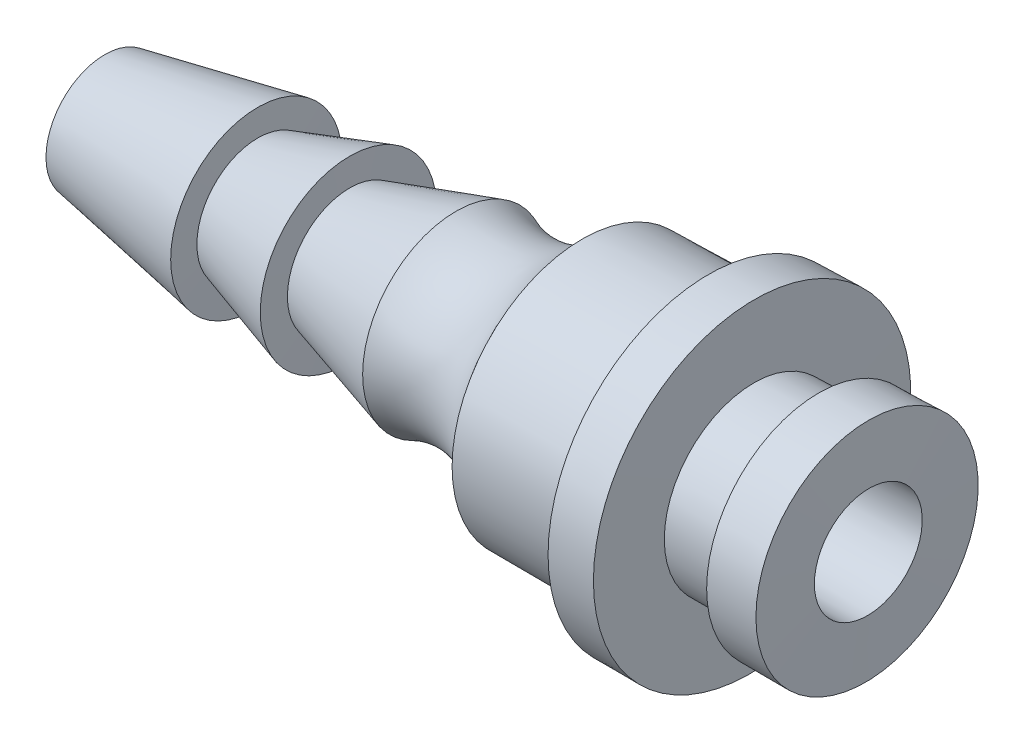
from build123d import *


with BuildPart() as part:
    # Sketch1 → Revolve1 (revolve)
    with BuildSketch(Plane(origin=(0, 0, 0), x_dir=(1, 0, 0), z_dir=(0, 1, 0))):
        with BuildLine():
            Line((-11.493478261, -0.960869565), (1.406521739, -0.960869565))
            Line((1.406521739, -0.960869565), (1.826198847, -1.279930678))
            Line((1.826198847, -1.279930678), (8.484993151, -1.279930678))
            Line((8.484993151, -1.279930678), (8.474039616, -2.818617799))
            Line((8.474039616, -2.818617799), (7.16746221, -2.818617799))
            Line((7.16746221, -2.818617799), (7.174039616, -2.247384123))
            Line((7.174039616, -2.247384123), (5.474039616, -2.247384123))
            Line((5.474039616, -2.247384123), (5.486521739, -4.139307546))
            Line((5.486521739, -4.139307546), (4.284364062, -4.139307546))
            Line((4.284364062, -4.139307546), (4.286521739, -3.385626586))
            Line((4.286521739, -3.385626586), (0.986521739, -3.385626586))
            ThreePointArc((0.986521739, -3.385626586), (-0.48998153, -2.304776001), (-2.313478261, -2.456958665))
            Line((-2.313478261, -2.456958665), (-5.093478261, -1.670869565))
            Line((-5.093478261, -1.670869565), (-5.093478261, -2.391060827))
            Line((-5.093478261, -2.391060827), (-7.493478261, -1.670869565))
            Line((-7.493478261, -1.670869565), (-7.499524272, -2.359905691))
            Line((-7.499524272, -2.359905691), (-11.493478261, -1.670869565))
            Line((-11.493478261, -1.670869565), (-11.493478261, -0.960869565))
        make_face()
    revolve(axis=Axis((-11.493478261, 0, 0.110869565), (0.9999010425950651, 0, -0.014067871811395011)))


solid = part.part
